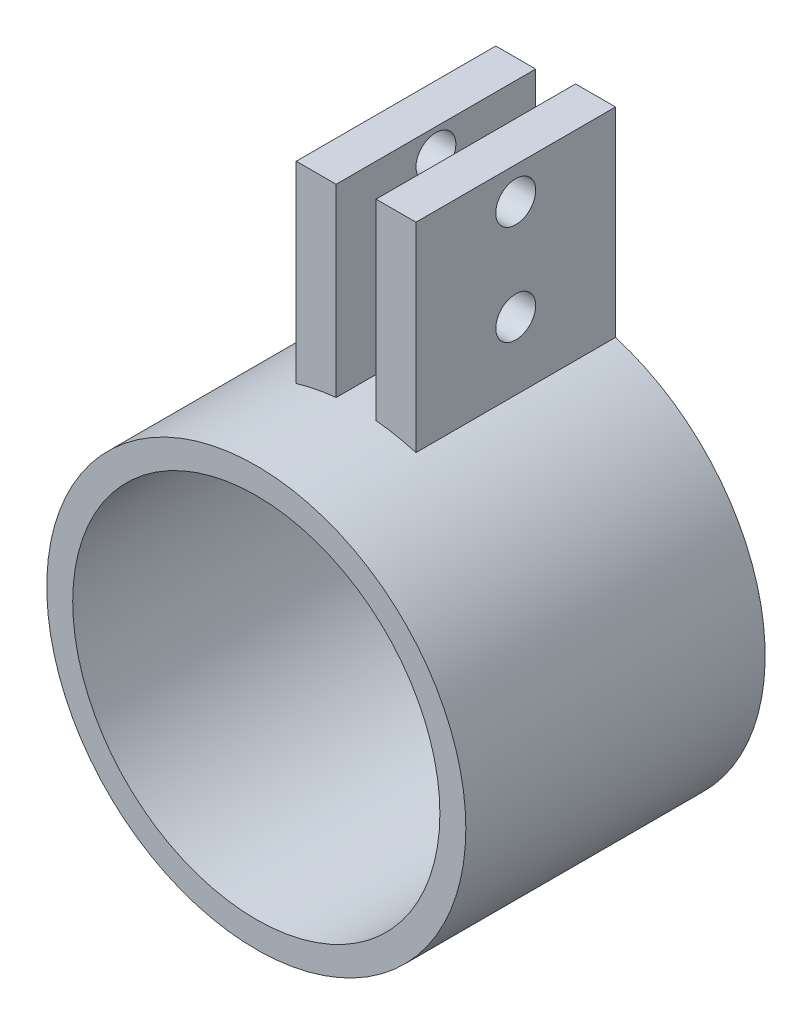
from build123d import *

# Parameters (mm, degrees)
SKETCH5_R               = 10.5
SKETCH5_R_2             = 9.2
BOSS_EXTRUDE1_DEPTH     = 15
SKETCH6_R               = 10.5
BOSS_EXTRUDE2_DEPTH     = 2
SKETCH7_W               = 2
SKETCH7_H               = 10
EXTRUDE_THIN1_DEPTH     = 10
SKETCH8_W               = 2
SKETCH8_H               = 9.64593802
EXTRUDE_THIN2_DEPTH     = 10
CUT_EXTRUDE1_DEPTH      = 29.456038339
CUT_EXTRUDE1_DEPTH_BACK = 29.456038339
SKETCH9_R               = 1


with BuildPart() as part:
    # Sketch5 → Boss-Extrude1 (new body)
    with BuildSketch(Plane.XY):
        Circle(SKETCH5_R)
        Circle(SKETCH5_R_2, mode=Mode.SUBTRACT)
    extrude(amount=BOSS_EXTRUDE1_DEPTH)

    # Sketch6 → Boss-Extrude2 (add)
    with BuildSketch(Plane.XY):
        Circle(SKETCH6_R)
    extrude(amount=BOSS_EXTRUDE2_DEPTH)

    # Sketch7 → Extrude-Thin1 (add)
    with BuildSketch(Plane(origin=(0, 0, 0), x_dir=(-1, 0, 0), z_dir=(0, 0, -1))):
        with Locations((-2, 15.062305899)):
            Rectangle(SKETCH7_W, SKETCH7_H)
    extrude(amount=-EXTRUDE_THIN1_DEPTH)

    # Sketch8 → Extrude-Thin2 (add)
    with BuildSketch(Plane(origin=(0, 0, 0), x_dir=(-1, 0, 0), z_dir=(0, 0, -1))):
        with Locations((2, 14.885274909)):
            Rectangle(SKETCH8_W, SKETCH8_H)
    extrude(amount=-EXTRUDE_THIN2_DEPTH)

    # Sketch9 → Cut-Extrude1 (cut, two sides: drawn at the far end of the back side and taken through both)
    with BuildSketch(Plane.ZY.offset(3).offset(-CUT_EXTRUDE1_DEPTH_BACK)):
        with Locations((5, 13.45227248)):
            Circle(SKETCH9_R)
        with Locations((5, 18.45227248)):
            Circle(SKETCH9_R)
    extrude(amount=CUT_EXTRUDE1_DEPTH + CUT_EXTRUDE1_DEPTH_BACK, mode=Mode.SUBTRACT)


solid = part.part
